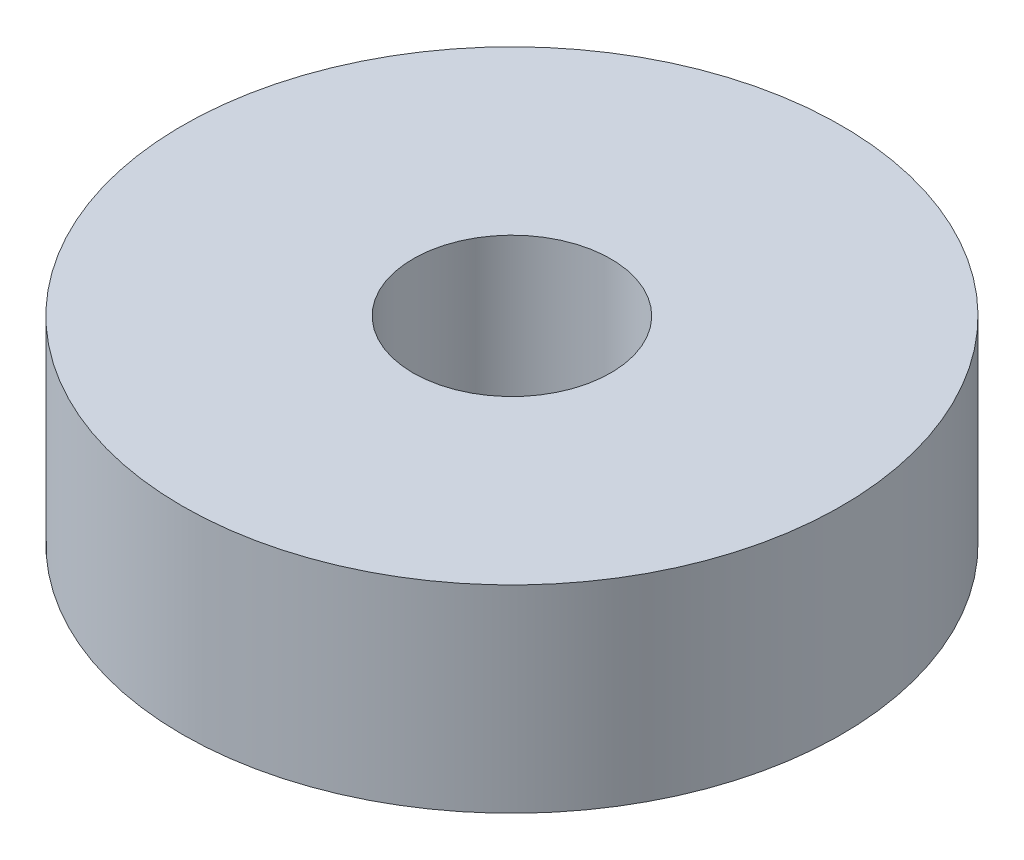
from build123d import *

# Parameters (mm, degrees)
SKETCH_1_R      = 5
SKETCH_1_R_2    = 1.5
EXTRUDE_1_DEPTH = 3


with BuildPart() as part:
    # 草图1 → 凸台-拉伸1 (new body)
    with BuildSketch(Plane(origin=(0, 0, 0), x_dir=(1, 0, 0), z_dir=(0, 1, 0))):
        with Locations(Location((0, 0, 0), (0, 0, 270))):
            Circle(SKETCH_1_R)
        with Locations(Location((0, 0, 0), (0, 0, 270))):
            Circle(SKETCH_1_R_2, mode=Mode.SUBTRACT)
    extrude(amount=EXTRUDE_1_DEPTH)


solid = part.part
